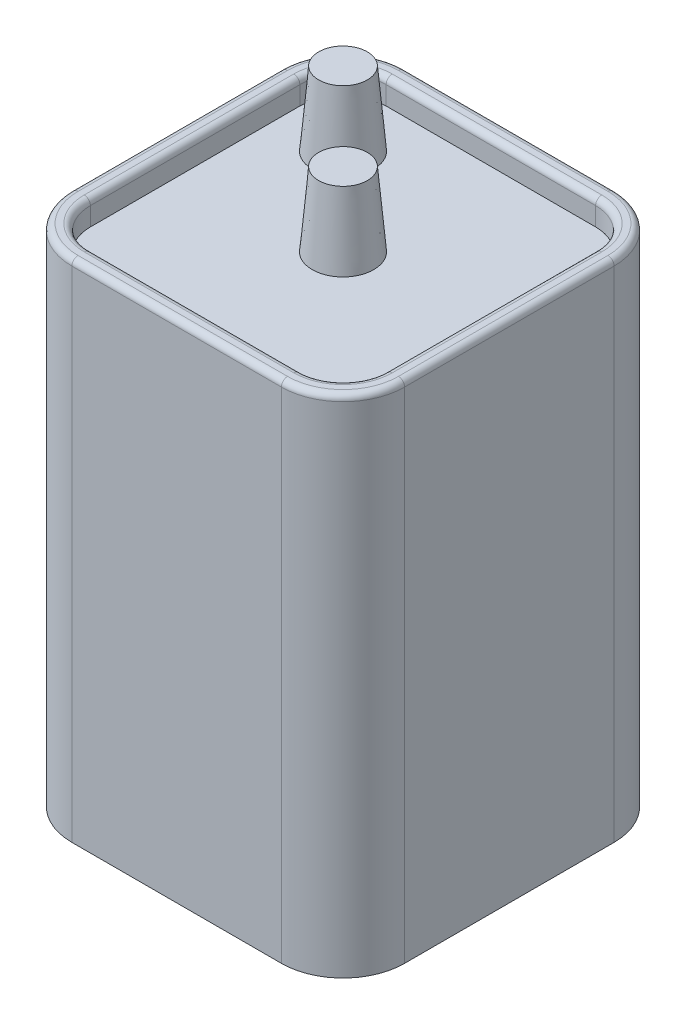
from build123d import *

# Parameters (mm, degrees)
SKETCH1_W                 = 68.58
SKETCH1_H                 = 68.58
BOSS_EXTRUDE1_DEPTH       = 104.14
SIDE_FILLETS_R            = 12.7
TOP_CUT_DEPTH             = 5.08
TOP_FACE_FILLET_R         = 1.27
SKETCH_TERMINALS_R        = 6.35
TERMINALS_DEPTH           = 15.24
TERMINALS_DRAFT           = 5
TERMINALS_PROFILE_2_DEPTH = 15.24
TERMINALS_PROFILE_2_DRAFT = 5


with BuildPart() as part:
    # Sketch1 → Boss-Extrude1 (new body)
    with BuildSketch(Plane(origin=(0, 0, 0), x_dir=(1, 0, 0), z_dir=(0, 1, 0))):
        Rectangle(SKETCH1_W, SKETCH1_H)
    extrude(amount=BOSS_EXTRUDE1_DEPTH)

    # Side Fillets
    side_fillets_edges = [part.edges().sort_by_distance(p)[0] for p in [
        (34.29, 52.07, 34.29),
        (-34.29, 52.07, 34.29),
        (-34.29, 52.07, -34.29),
        (34.29, 52.07, -34.29),
    ]]
    fillet(side_fillets_edges, radius=SIDE_FILLETS_R)

    # Sketch2 → Top Cut (cut)
    with BuildSketch(Plane(origin=(0, 104.14, 0), x_dir=(1, 0, 0), z_dir=(0, 1, 0))):
        with BuildLine():
            Line((21.59, 30.48), (-21.59, 30.48))
            ThreePointArc((-21.59, 30.48), (-27.876179285, 27.876179285), (-30.48, 21.59))
            Line((-30.48, 21.59), (-30.48, -21.59))
            ThreePointArc((-30.48, -21.59), (-27.876179285, -27.876179285), (-21.59, -30.48))
            Line((-21.59, -30.48), (21.59, -30.48))
            ThreePointArc((21.59, -30.48), (27.876179285, -27.876179285), (30.48, -21.59))
            Line((30.48, -21.59), (30.48, 21.59))
            ThreePointArc((30.48, 21.59), (27.876179285, 27.876179285), (21.59, 30.48))
        make_face()
    extrude(amount=-TOP_CUT_DEPTH, mode=Mode.SUBTRACT)

    # Top Face Fillet
    top_face_fillet_edges = [part.edges().sort_by_distance(p)[0] for p in [
        (-34.29, 104.14, 0),
        (0, 104.14, -34.29),
        (34.29, 104.14, 0),
        (0, 104.14, 34.29),
        (-30.570256121, 104.14, 30.570256121),
        (30.570256121, 104.14, 30.570256121),
        (30.570256121, 104.14, -30.570256121),
        (-30.570256121, 104.14, -30.570256121),
        (27.876179285, 104.14, -27.876179285),
        (0, 104.14, -30.48),
        (-27.876179285, 104.14, -27.876179285),
        (-30.48, 104.14, 0),
        (-27.876179285, 104.14, 27.876179285),
        (0, 104.14, 30.48),
        (27.876179285, 104.14, 27.876179285),
        (30.48, 104.14, 0),
    ]]
    fillet(top_face_fillet_edges, radius=TOP_FACE_FILLET_R)


with BuildPart() as terminals_tool:
    # Sketch-TERMINALS → Terminals (with draft: the straight prism first)
    with BuildSketch(Plane(origin=(0, 99.06, 0), x_dir=(1, 0, 0), z_dir=(0, 1, 0))):
        Circle(SKETCH_TERMINALS_R)
    extrude(amount=TERMINALS_DEPTH)
    # Terminals: the draft: its side faces are tilted about the plane it starts from
    terminals_sides = [terminals_tool.faces().sort_by_distance(p)[0] for p in [
        (-6.35, 106.68, 0),
    ]]
    draft(terminals_sides, Plane(origin=(0, 99.06, 0), x_dir=(1, 0, 0), z_dir=(0, 1, 0)), TERMINALS_DRAFT)


with BuildPart() as part_1:
    add(part.part)

    # Terminals: add terminals_tool
    add(terminals_tool.part)


with BuildPart() as terminals_profile_2_tool:
    # Sketch-TERMINALS → Terminals profile 2 (with draft: the straight prism first)
    with BuildSketch(Plane(origin=(0, 99.06, 0), x_dir=(1, 0, 0), z_dir=(0, 1, 0))):
        with Locations((-17.960512242, 17.960512242)):
            Circle(SKETCH_TERMINALS_R)
    extrude(amount=TERMINALS_PROFILE_2_DEPTH)
    # Terminals profile 2: the draft: its side faces are tilted about the plane it starts from
    terminals_profile_2_sides = [terminals_profile_2_tool.faces().sort_by_distance(p)[0] for p in [
        (-24.310512242, 106.68, -17.960512242),
    ]]
    draft(terminals_profile_2_sides, Plane(origin=(0, 99.06, 0), x_dir=(1, 0, 0), z_dir=(0, 1, 0)), TERMINALS_PROFILE_2_DRAFT)


with BuildPart() as part_2:
    add(part_1.part)

    # Terminals profile 2: add terminals_profile_2_tool
    add(terminals_profile_2_tool.part)


solid = part_2.part
